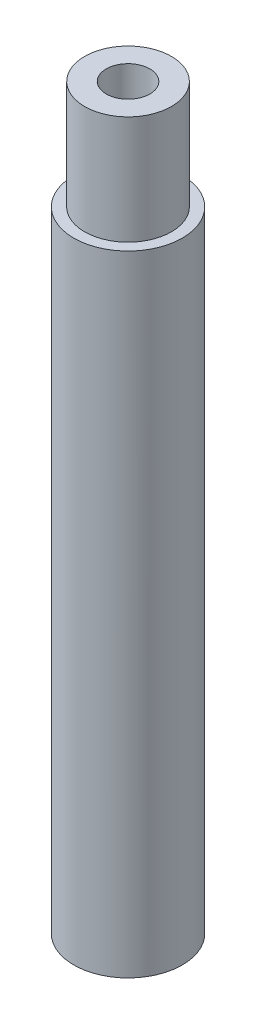
from build123d import *

# Parameters (mm, degrees)
SKETCH1_R           = 15.875
SKETCH1_R_2         = 6.3754
BOSS_EXTRUDE1_DEPTH = 203.2
BOSS_EXTRUDE2_START = 12.7
SKETCH2_R           = 15.875
SKETCH2_R_2         = 12.7
BOSS_EXTRUDE2_DEPTH = 12.7
CUT_EXTRUDE1_START  = -31.75
SKETCH3_R           = 15.875
SKETCH3_R_2         = 12.7
CUT_EXTRUDE1_DEPTH  = 31.75


with BuildPart() as part:
    # Sketch1 → Boss-Extrude1 (new body)
    with BuildSketch(Plane(origin=(0, 0, 0), x_dir=(1, 0, 0), z_dir=(0, 1, 0))):
        with Locations(Location((0, 0, 0), (0, 0, 270))):
            Circle(SKETCH1_R)
        with Locations(Location((0, 0, 0), (0, 0, 270))):
            Circle(SKETCH1_R_2, mode=Mode.SUBTRACT)
    extrude(amount=BOSS_EXTRUDE1_DEPTH)

    # Sketch2 → Boss-Extrude2 (add)
    with BuildSketch(Plane.XZ.offset(BOSS_EXTRUDE2_START)):
        with Locations(Location((0, 0, 0), (0, 0, 270))):
            Circle(SKETCH2_R)
        with Locations(Location((0, 0, 0), (0, 0, 270))):
            Circle(SKETCH2_R_2, mode=Mode.SUBTRACT)
    extrude(amount=-BOSS_EXTRUDE2_DEPTH)

    # Sketch3 → Cut-Extrude1 (cut)
    with BuildSketch(Plane(origin=(0, 203.2, 0), x_dir=(1, 0, 0), z_dir=(0, 1, 0)).offset(CUT_EXTRUDE1_START)):
        with Locations(Location((0, 0, 0), (0, 0, 90))):
            Circle(SKETCH3_R)
        with Locations(Location((0, 0, 0), (0, 0, 90))):
            Circle(SKETCH3_R_2, mode=Mode.SUBTRACT)
    extrude(amount=CUT_EXTRUDE1_DEPTH, mode=Mode.SUBTRACT)


solid = part.part
